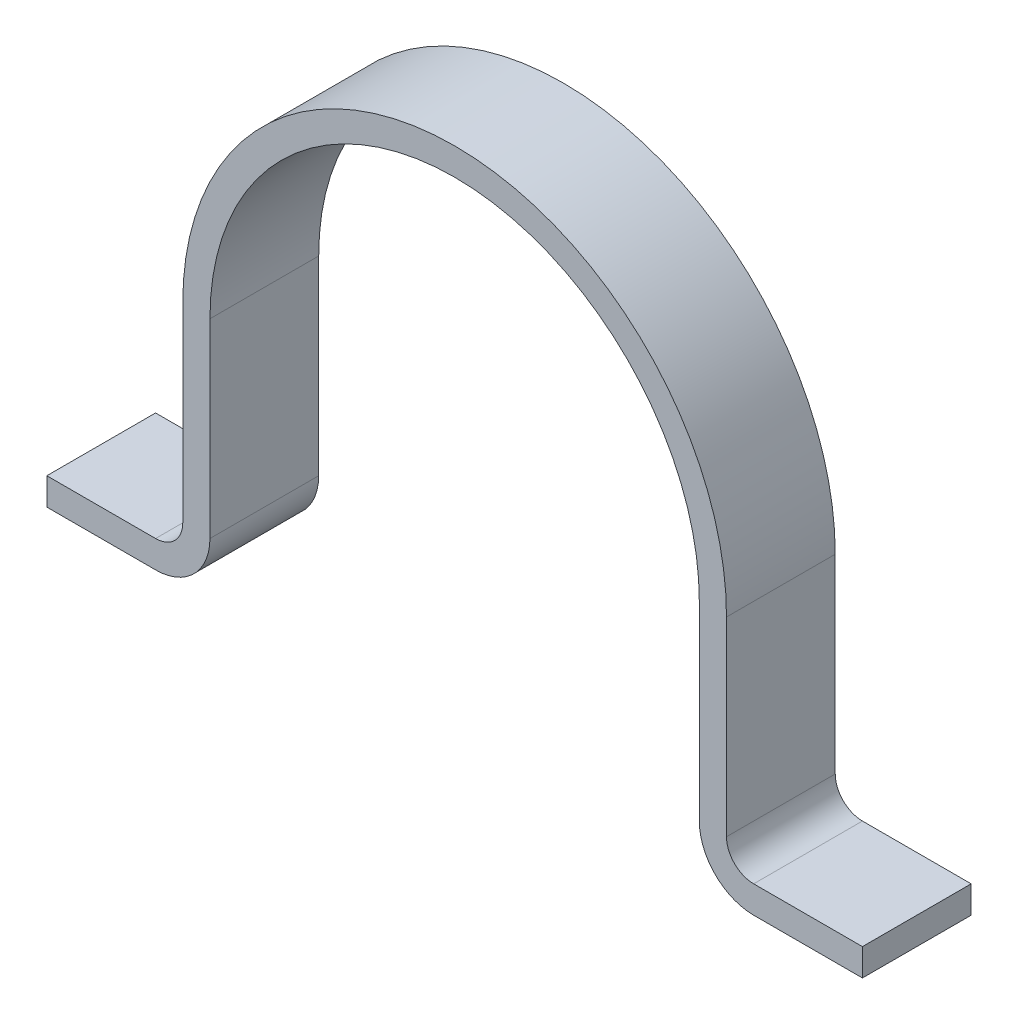
from build123d import *

# Parameters (mm, degrees)
BOSS_EXTRUDE3_DEPTH = 10


with BuildPart() as part:
    # Sketch5 → Boss-Extrude3 (new body)
    with BuildSketch(Plane.XY):
        with BuildLine():
            Line((0, 0), (0, -17.5))
            ThreePointArc((0, -17.5), (-1.464466094, -21.035533906), (-5, -22.5))
            Line((-5, -22.5), (-15, -22.5))
            Line((-15, -22.5), (-15, -20))
            Line((-15, -20), (-5, -20))
            ThreePointArc((-5, -20), (-3.232233047, -19.267766953), (-2.5, -17.5))
            Line((-2.5, -17.5), (-2.5, -0.001325618))
            ThreePointArc((-2.5, -0.001325618), (22.5, 25.024519835), (47.5, -0.001325618))
            Line((47.5, -0.001325618), (47.5, -17.5))
            ThreePointArc((47.5, -17.5), (48.232233047, -19.267766953), (50, -20))
            Line((50, -20), (60, -20))
            Line((60, -20), (60, -22.5))
            Line((60, -22.5), (50, -22.5))
            ThreePointArc((50, -22.5), (46.464466094, -21.035533906), (45, -17.5))
            Line((45, -17.5), (45, 0))
            ThreePointArc((45, 0), (22.5, 22.524519835), (0, 0))
        make_face()
    extrude(amount=BOSS_EXTRUDE3_DEPTH)


solid = part.part
